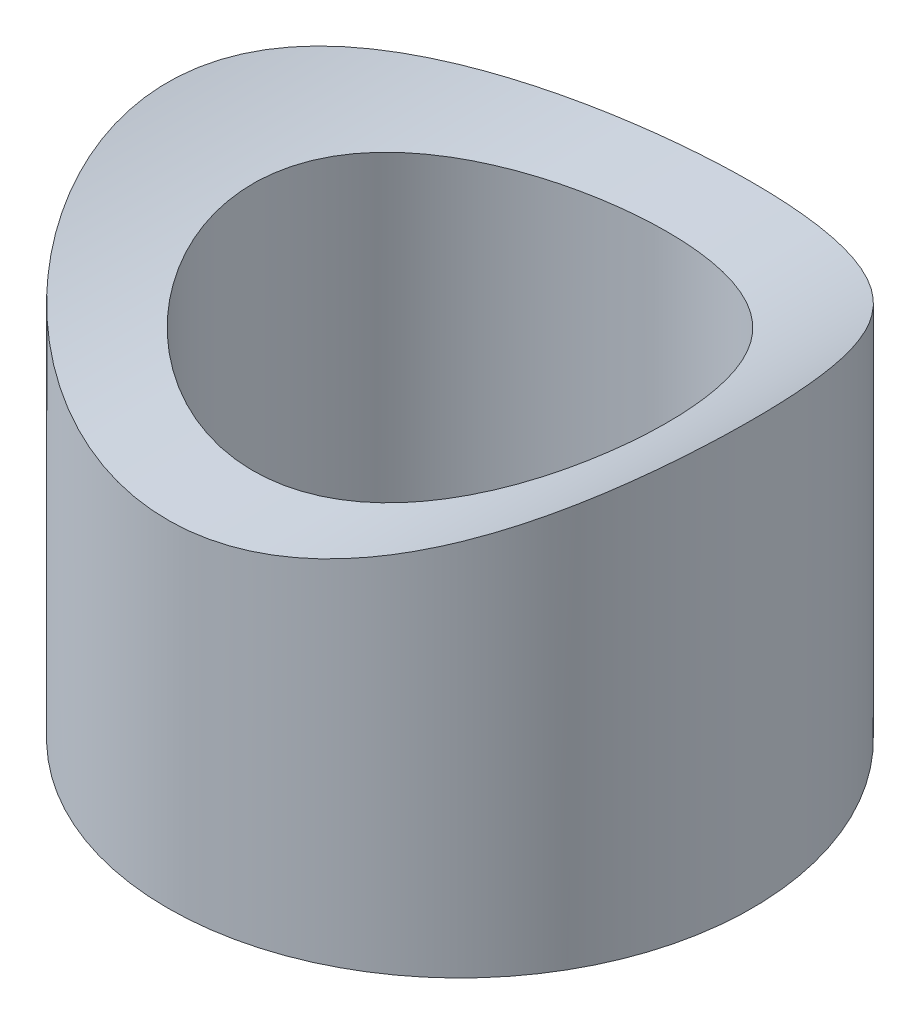
from build123d import *

# Parameters (mm, degrees)
SKETCH1_R               = 6
SKETCH1_R_2             = 4.25
BOSS_EXTRUDE1_DEPTH     = 6.9
SKETCH2_R               = 6
SKETCH2_R_2             = 4.25
BOSS_EXTRUDE2_DEPTH     = 4
CUT_EXTRUDE1_DEPTH      = 14.813399292
CUT_EXTRUDE1_DEPTH_BACK = 14.813399292
SKETCH3_R               = 11


with BuildPart() as part:
    # Sketch1 → Boss-Extrude1 (new body)
    with BuildSketch(Plane(origin=(0, 0, 0), x_dir=(1, 0, 0), z_dir=(0, 1, 0))):
        with Locations(Location((0, 0, 0), (0, 0, 90))):
            Circle(SKETCH1_R)
        with Locations(Location((0, 0, 0), (0, 0, 90))):
            Circle(SKETCH1_R_2, mode=Mode.SUBTRACT)
    extrude(amount=BOSS_EXTRUDE1_DEPTH)

    # Sketch2 → Boss-Extrude2 (add)
    with BuildSketch(Plane(origin=(0, 6.9, 0), x_dir=(1, 0, 0), z_dir=(0, 1, 0))):
        with Locations(Location((0, 0, 0), (0, 0, 90))):
            Circle(SKETCH2_R)
        with Locations(Location((0, 0, 0), (0, 0, 90))):
            Circle(SKETCH2_R_2, mode=Mode.SUBTRACT)
    extrude(amount=BOSS_EXTRUDE2_DEPTH)

    # Sketch3 → Cut-Extrude1 (cut, two sides: drawn at the far end of the back side and taken through both)
    with BuildSketch(Plane.XY.offset(-CUT_EXTRUDE1_DEPTH_BACK)):
        with Locations((0, 17.9)):
            Circle(SKETCH3_R)
    extrude(amount=CUT_EXTRUDE1_DEPTH + CUT_EXTRUDE1_DEPTH_BACK, mode=Mode.SUBTRACT)


solid = part.part
